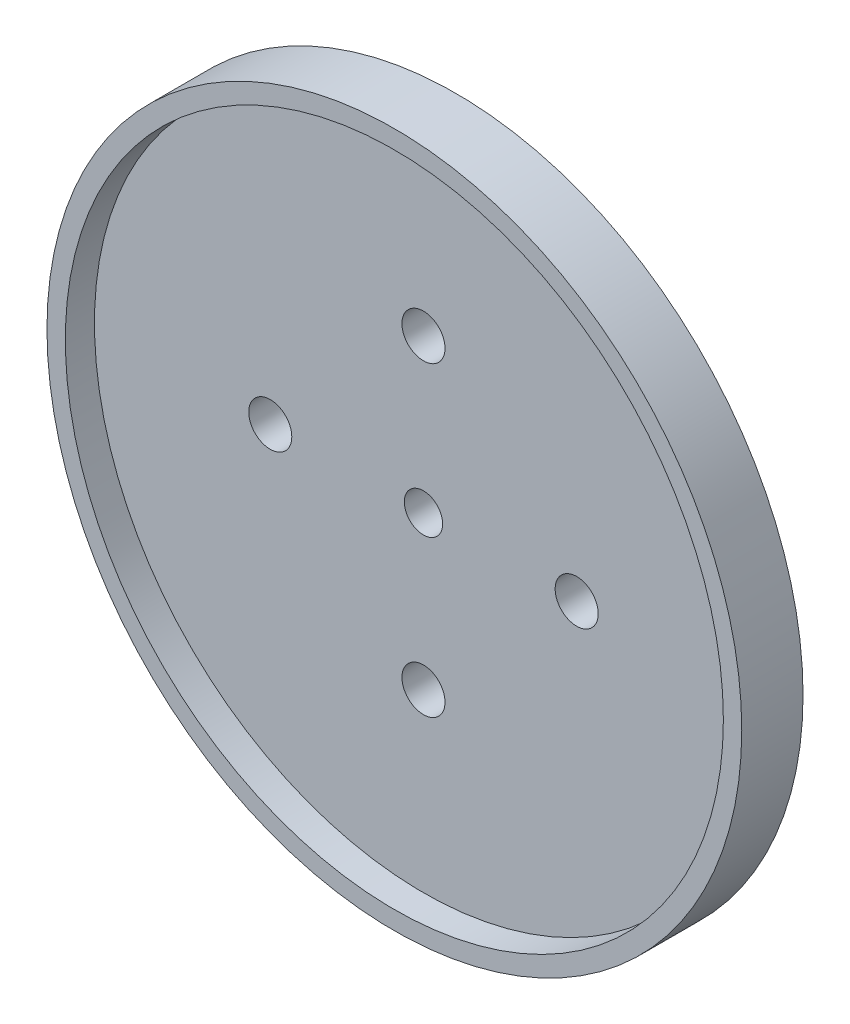
from build123d import *

# Parameters (mm, degrees)
SKETCH1_R                       = 57.5945
EXTRUDE1_DEPTH                  = 10.16
SKETCH2_R                       = 54.5465
EXTRUDE2_DEPTH                  = 4.826
F_1_4_0_25_DIAMETER_HOLE1_D     = 6.35
F_1_4_0_25_DIAMETER_HOLE1_DEPTH = 6.35
F_1_4_0_25_DIAMETER_HOLE1_TIP   = 1.907732465
F_1_4_CLEARANCE_HOLE1_D         = 7.14248
CIRPATTERN1_COUNT               = 4


with BuildPart() as part:
    # Sketch1 → Extrude1 (new body)
    with BuildSketch(Plane.XY):
        Circle(SKETCH1_R)
    extrude(amount=EXTRUDE1_DEPTH)

    # Sketch2 → Extrude2 (cut)
    with BuildSketch(Plane.XY.offset(10.16)):
        Circle(SKETCH2_R)
    extrude(amount=-EXTRUDE2_DEPTH, mode=Mode.SUBTRACT)

    # 1/4 (0.25) Diameter Hole1
    with Locations(Plane.XY.offset(5.334)):
        with Locations((0, 0)):
            Hole(F_1_4_0_25_DIAMETER_HOLE1_D / 2, depth=F_1_4_0_25_DIAMETER_HOLE1_DEPTH)
            with Locations((0, 0, -(F_1_4_0_25_DIAMETER_HOLE1_DEPTH + F_1_4_0_25_DIAMETER_HOLE1_TIP / 2))):  # 118° drill point
                Cone(0, F_1_4_0_25_DIAMETER_HOLE1_D / 2, F_1_4_0_25_DIAMETER_HOLE1_TIP, mode=Mode.SUBTRACT)

    # 1/4 Clearance Hole1 (through all)
    with Locations(Plane(origin=(25.4, 0, 5.334), x_dir=(1, 0, 0), z_dir=(0, 0, 1))):
        with Locations((0, 0)):
            f_1_4_clearance_hole1 = Hole(F_1_4_CLEARANCE_HOLE1_D / 2)

    # CirPattern1: 1/4 Clearance Hole1 ×4 about axis
    cirpattern1_axis = Axis((0, 0, 0), (0, 0, 1))
    for i in range(1, CIRPATTERN1_COUNT):
        add(f_1_4_clearance_hole1.rotate(cirpattern1_axis, i * 360 / CIRPATTERN1_COUNT), mode=Mode.SUBTRACT)


solid = part.part
